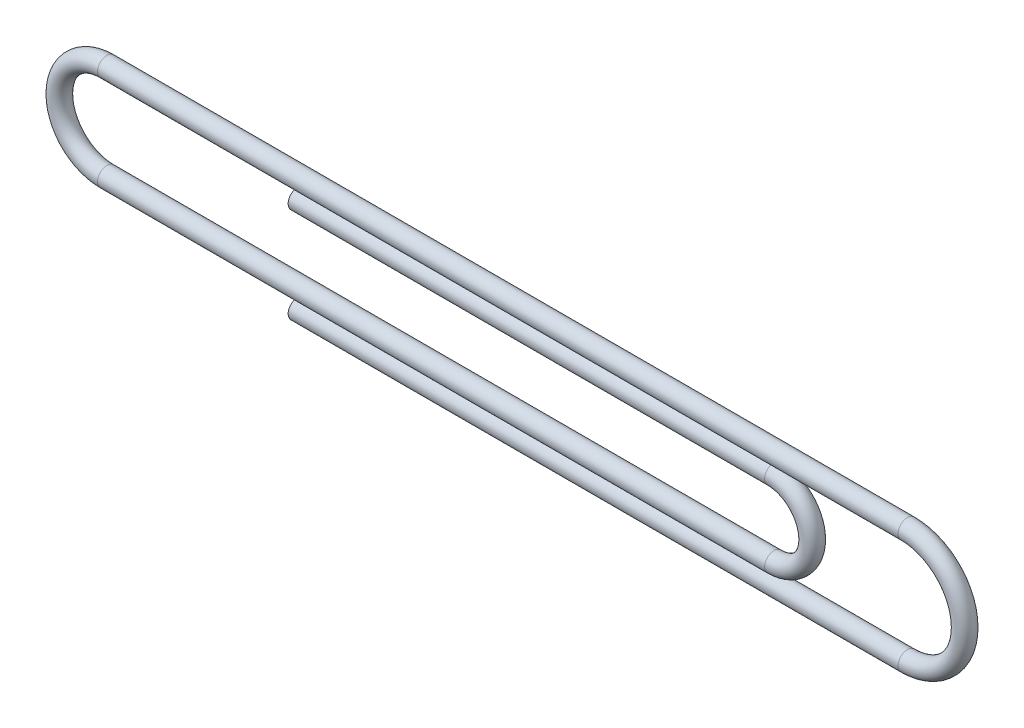
from build123d import *

# Parameters (mm, degrees)
SWEEP1_PROFILE_R = 0.495


with BuildPart() as part:
    # Sweep1: sweep along a path in Sketch1
    with BuildLine(Plane.XY) as sweep1_path:
        Line((-8.345323741, 2.111510791), (16.654676259, 2.111510791))
        ThreePointArc((16.654676259, 2.111510791), (18.654676259, 0.111510791), (16.654676259, -1.888489209))
        Line((16.654676259, -1.888489209), (-18.345323741, -1.888489209))
        ThreePointArc((-18.345323741, -1.888489209), (-20.845323741, 0.611510791), (-18.345323741, 3.111510791))
        Line((-18.345323741, 3.111510791), (23.654676259, 3.111510791))
        ThreePointArc((23.654676259, 3.111510791), (26.654676259, 0.111510791), (23.654676259, -2.888489209))
        Line((23.654676259, -2.888489209), (-8.345323741, -2.888489209))
    # Sweep1 profile (on start of the path) → Sweep1 (sweep)
    with BuildSketch(Plane(origin=(-8.345323741, 2.111510791, 0), x_dir=(0, 1, 0), z_dir=(1, 0, 0))):
        Circle(SWEEP1_PROFILE_R)
    sweep(path=sweep1_path.line)


solid = part.part
